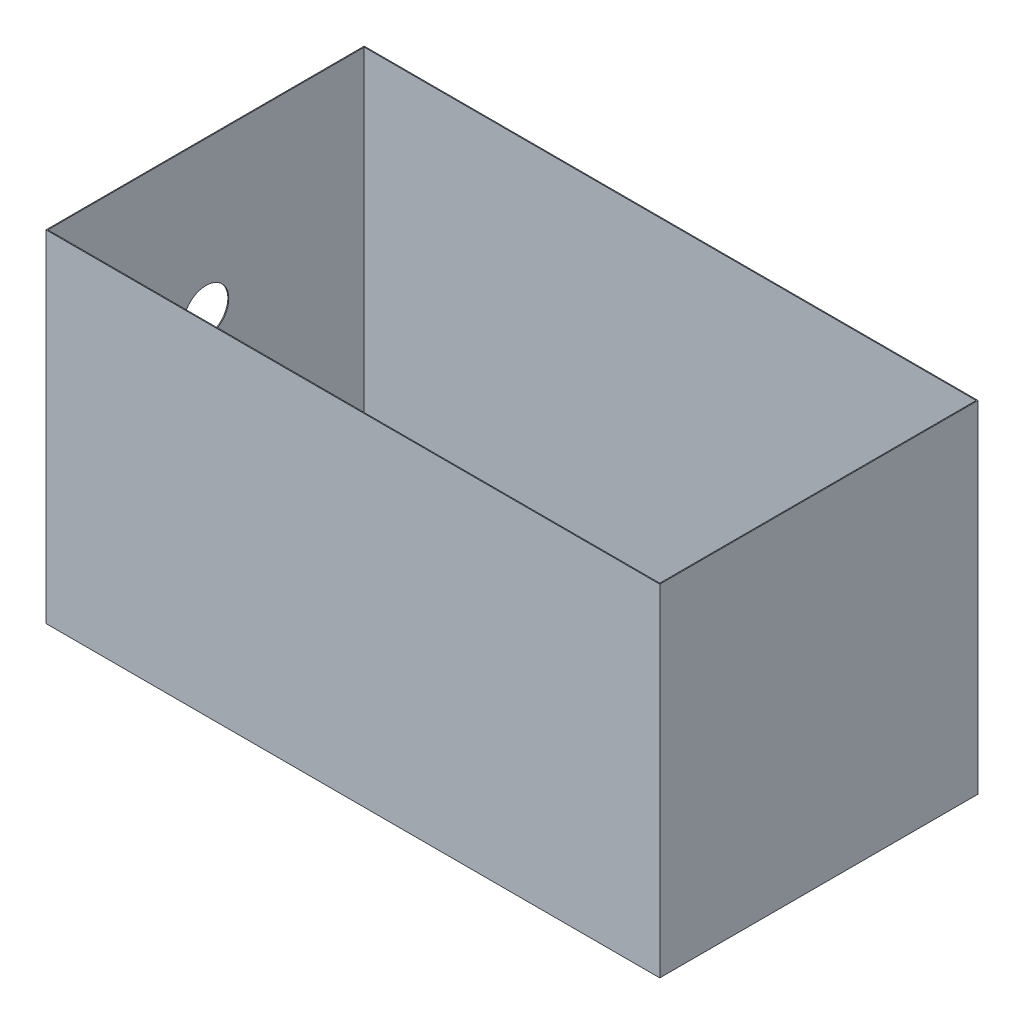
from build123d import *

# Parameters (mm, degrees)
MASTER_FOOTPRINT_W    = 1350
MASTER_FOOTPRINT_H    = 700
BATH_BASE_PLATE_DEPTH = 750
BATH_SHELL_2MM_T      = -2
SKETCH_1_R            = 50
INLET_D100_CUT_DEPTH  = 10


with BuildPart() as part:
    # MASTER_FOOTPRINT → BATH_BASE_PLATE (new body)
    with BuildSketch(Plane(origin=(0, 0, 0), x_dir=(1, 0, 0), z_dir=(0, 1, 0))):
        with Locations((675, 350)):
            Rectangle(MASTER_FOOTPRINT_W, MASTER_FOOTPRINT_H)
    extrude(amount=BATH_BASE_PLATE_DEPTH)

    # BATH_SHELL_2MM
    bath_shell_2mm_openings = [part.faces().sort_by_distance(p)[0] for p in [
        (675, 750, -350),
    ]]
    offset(amount=BATH_SHELL_2MM_T, openings=bath_shell_2mm_openings, kind=Kind.INTERSECTION)

    # Эскиз1 → INLET_D100_CUT (cut)
    with BuildSketch(Plane(origin=(0, 0, 0), x_dir=(0, 0, -1), z_dir=(1, 0, 0))):
        with Locations((350, 420)):
            Circle(SKETCH_1_R)
    extrude(amount=INLET_D100_CUT_DEPTH, mode=Mode.SUBTRACT)


solid = part.part
